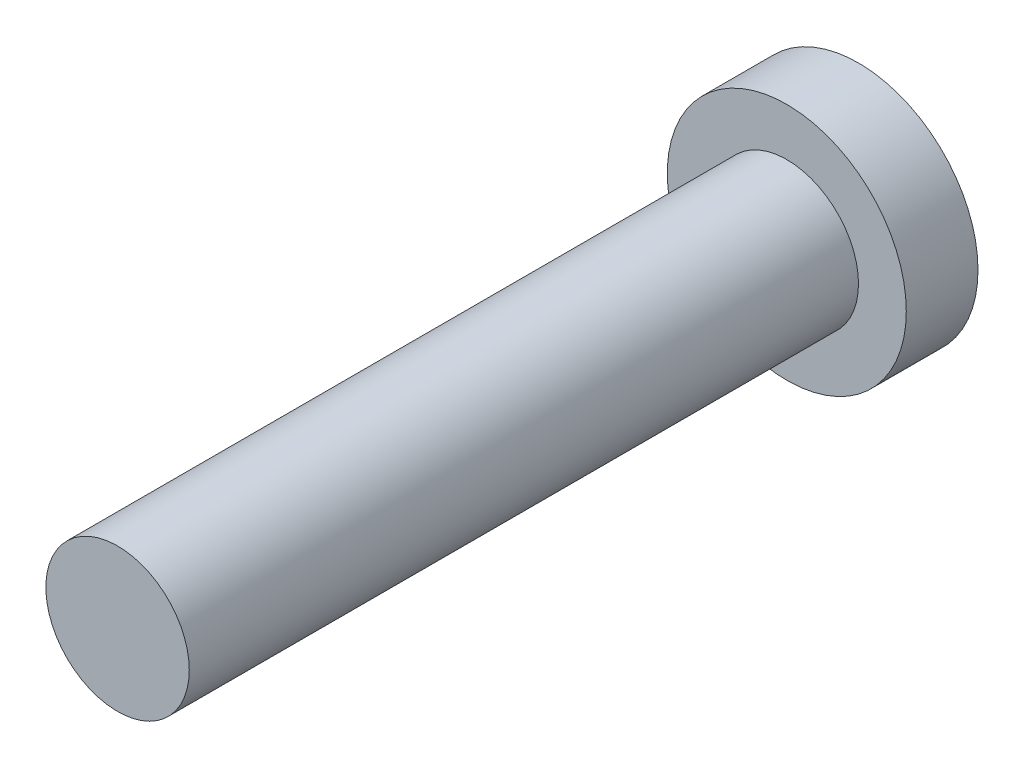
from build123d import *

# Parameters (mm, degrees)
SKETCH1_R           = 2.5
BOSS_EXTRUDE2_DEPTH = 1.5
SKETCH4_R           = 1.5
BOSS_EXTRUDE3_DEPTH = 14


with BuildPart() as part:
    # Sketch1 → Boss-Extrude2 (new body)
    with BuildSketch(Plane.XY):
        Circle(SKETCH1_R)
    extrude(amount=BOSS_EXTRUDE2_DEPTH)

    # Sketch4 → Boss-Extrude3 (add)
    with BuildSketch(Plane.XY.offset(1.5)):
        Circle(SKETCH4_R)
    extrude(amount=BOSS_EXTRUDE3_DEPTH)


solid = part.part
